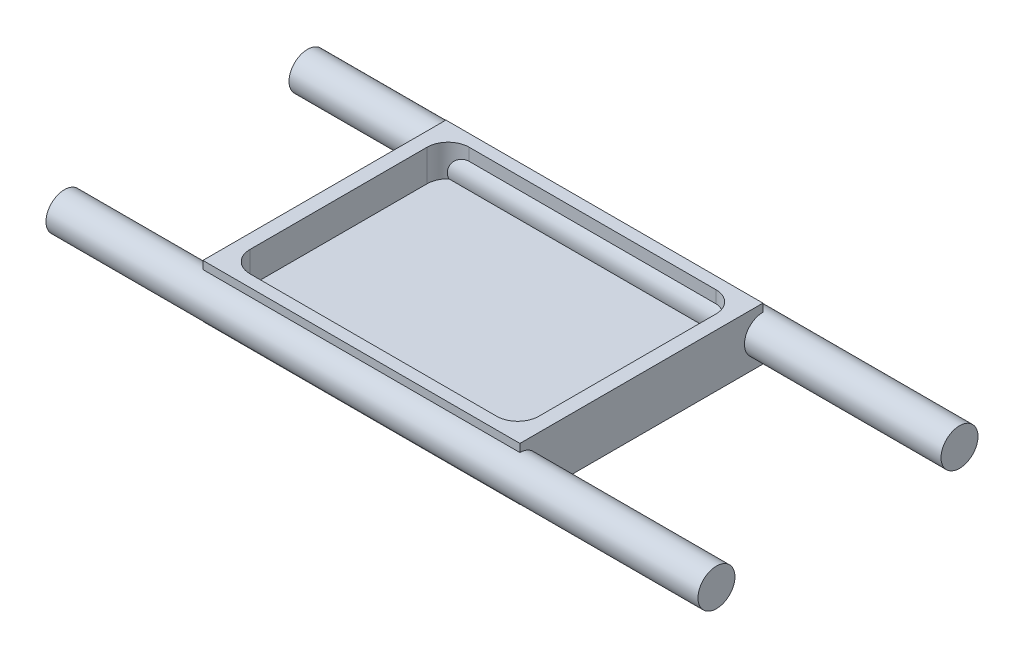
from build123d import *

# Parameters (mm, degrees)
SKETCH1_W                = 300
SKETCH1_H                = 230
BOSS_EXTRUDE1_DEPTH      = 50
CUT_EXTRUDE1_DEPTH       = 30
BOSS_EXTRUDE2_DEPTH      = 186
BOSS_EXTRUDE2_DEPTH_BACK = 431
SKETCH3_R                = 17.5


with BuildPart() as part:
    # Sketch1 → Boss-Extrude1 (new body)
    with BuildSketch(Plane(origin=(0, 0, 0), x_dir=(1, 0, 0), z_dir=(0, 1, 0))):
        Rectangle(SKETCH1_W, SKETCH1_H)
    extrude(amount=BOSS_EXTRUDE1_DEPTH)

    # Sketch2 → Cut-Extrude1 (cut)
    with BuildSketch(Plane(origin=(0, 50, 0), x_dir=(1, 0, 0), z_dir=(0, 1, 0))):
        with BuildLine():
            Line((116.702187757, 103.747196066), (-116.702187757, 103.747196066))
            ThreePointArc((-116.702187757, 103.747196066), (-130.844323381, 97.889331689), (-136.702187757, 83.747196066))
            Line((-136.702187757, 83.747196066), (-136.702187757, -83.747196066))
            ThreePointArc((-136.702187757, -83.747196066), (-130.844323381, -97.889331689), (-116.702187757, -103.747196066))
            Line((-116.702187757, -103.747196066), (116.702187757, -103.747196066))
            ThreePointArc((116.702187757, -103.747196066), (130.844323381, -97.889331689), (136.702187757, -83.747196066))
            Line((136.702187757, -83.747196066), (136.702187757, 83.747196066))
            ThreePointArc((136.702187757, 83.747196066), (130.844323381, 97.889331689), (116.702187757, 103.747196066))
        make_face()
    extrude(amount=-CUT_EXTRUDE1_DEPTH, mode=Mode.SUBTRACT)

    # Sketch3 → Boss-Extrude2 (add, two sides: drawn at the far end of the back side and taken through both)
    with BuildSketch(Plane(origin=(150, 0, 0), x_dir=(0, 0, -1), z_dir=(1, 0, 0)).offset(-BOSS_EXTRUDE2_DEPTH_BACK)):
        with Locations((115, 25)):
            Circle(SKETCH3_R)
        with Locations((-115, 25)):
            Circle(SKETCH3_R)
    extrude(amount=BOSS_EXTRUDE2_DEPTH + BOSS_EXTRUDE2_DEPTH_BACK)


solid = part.part
